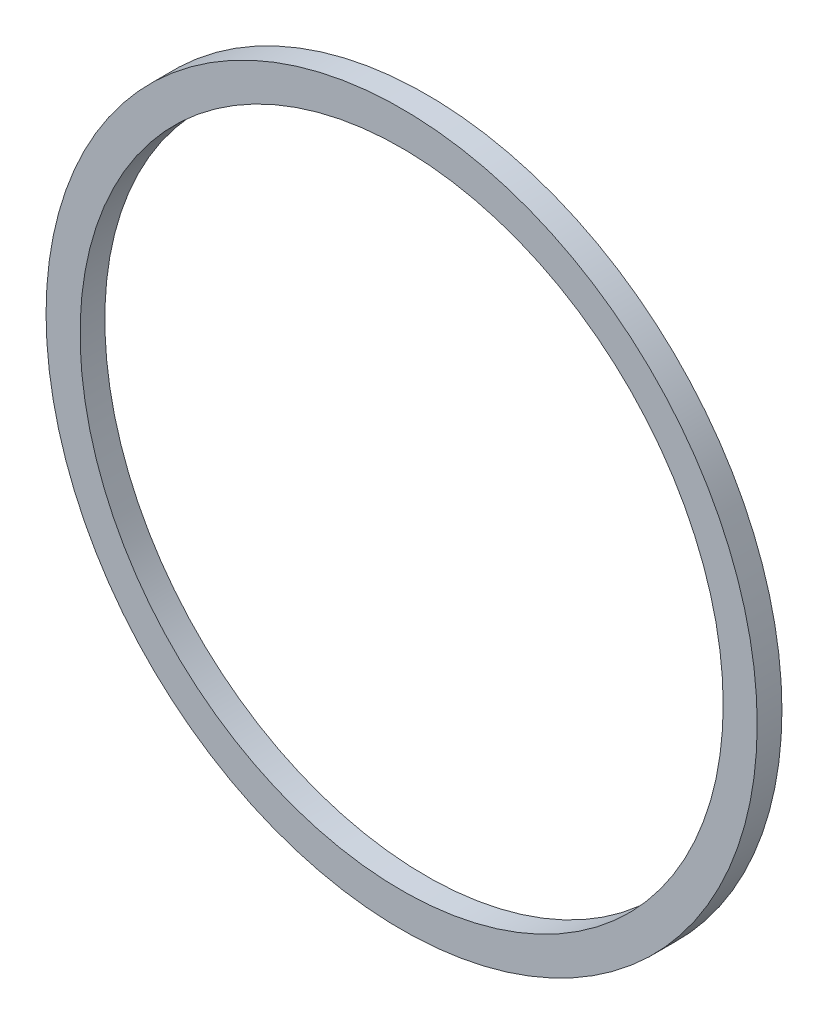
from build123d import *

# Parameters (mm, degrees)
SKETCH1_R      = 7.187528636
SKETCH1_R_2    = 6.5
EXTRUDE1_DEPTH = 0.5


with BuildPart() as part:
    # Sketch1 → Extrude1 (new body)
    with BuildSketch(Plane.XY):
        Circle(SKETCH1_R)
        Circle(SKETCH1_R_2, mode=Mode.SUBTRACT)
    extrude(amount=EXTRUDE1_DEPTH)


solid = part.part
